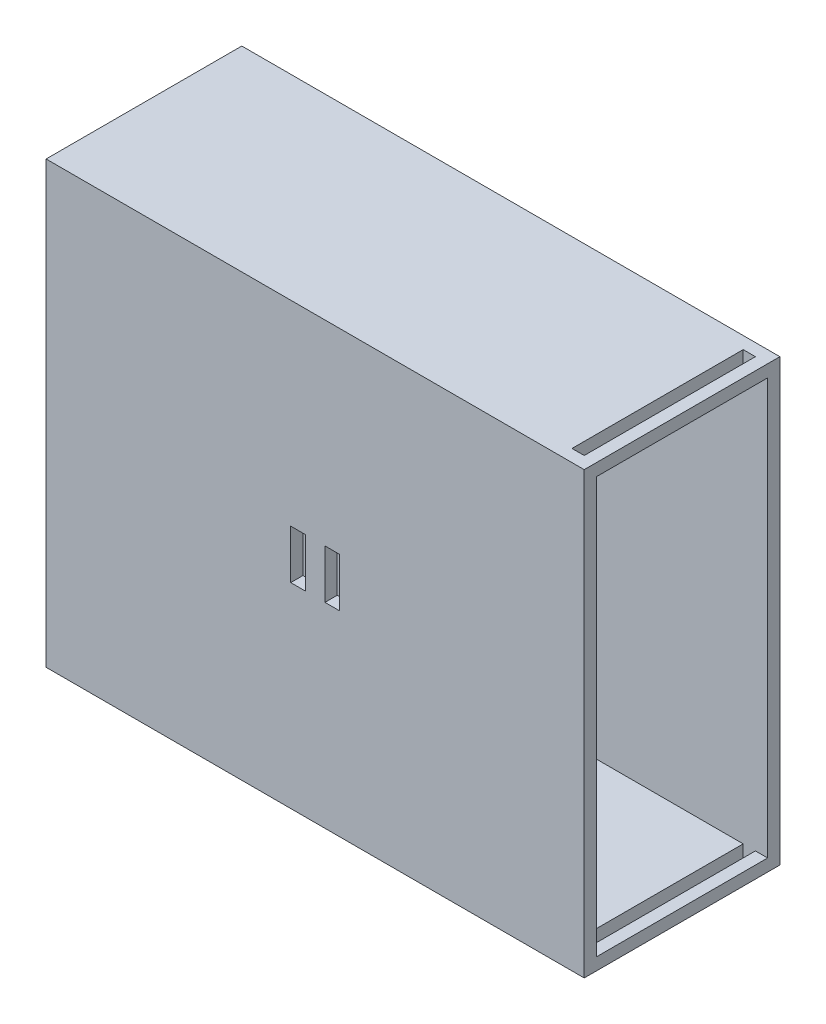
from build123d import *

# Parameters (mm, degrees)
MAIN_BODY_W                        = 279.4
MAIN_BODY_H                        = 228.6
MAIN_BODY_EXTRUDE_DEPTH            = 101.6
SKETCH2_W                          = 88.9
SKETCH2_H                          = 215.9
MAIN_BODY_HOLLOW_EXTRUDE_CUT_DEPTH = 273.05
SKETCH3_W                          = 6.35
SKETCH3_H                          = 88.9
SLIDING_DOOR_EXTRUDE_CUT_DEPTH     = 273.05
SKETCH4_W                          = 7.62
SKETCH4_H                          = 25.4
CUT_EXTRUDE3_DEPTH                 = 25.4


with BuildPart() as part:
    # Main Body → Main Body Extrude (new body)
    with BuildSketch(Plane.XY):
        with Locations((60.02161481, -114.3)):
            Rectangle(MAIN_BODY_W, MAIN_BODY_H)
    extrude(amount=MAIN_BODY_EXTRUDE_DEPTH)

    # Sketch2 → Main Body Hollow Extrude Cut (cut)
    with BuildSketch(Plane(origin=(199.72161481, 0, 0), x_dir=(0, 0, -1), z_dir=(1, 0, 0))):
        with Locations((-50.8, -114.3)):
            Rectangle(SKETCH2_W, SKETCH2_H)
    extrude(amount=-MAIN_BODY_HOLLOW_EXTRUDE_CUT_DEPTH, mode=Mode.SUBTRACT)

    # Sketch3 → Sliding Door Extrude Cut (cut)
    with BuildSketch(Plane(origin=(0, 0, 0), x_dir=(1, 0, 0), z_dir=(0, 1, 0))):
        with Locations((190.19661481, -50.8)):
            Rectangle(SKETCH3_W, SKETCH3_H)
    extrude(amount=-SLIDING_DOOR_EXTRUDE_CUT_DEPTH, mode=Mode.SUBTRACT)

    # Sketch4 → Cut-Extrude3 (cut)
    with BuildSketch(Plane.XY.offset(101.6)):
        with Locations((51.13161481, -114.3)):
            Rectangle(SKETCH4_W, SKETCH4_H)
        with Locations((68.91161481, -114.3)):
            Rectangle(SKETCH4_W, SKETCH4_H)
    extrude(amount=-CUT_EXTRUDE3_DEPTH, mode=Mode.SUBTRACT)


solid = part.part
